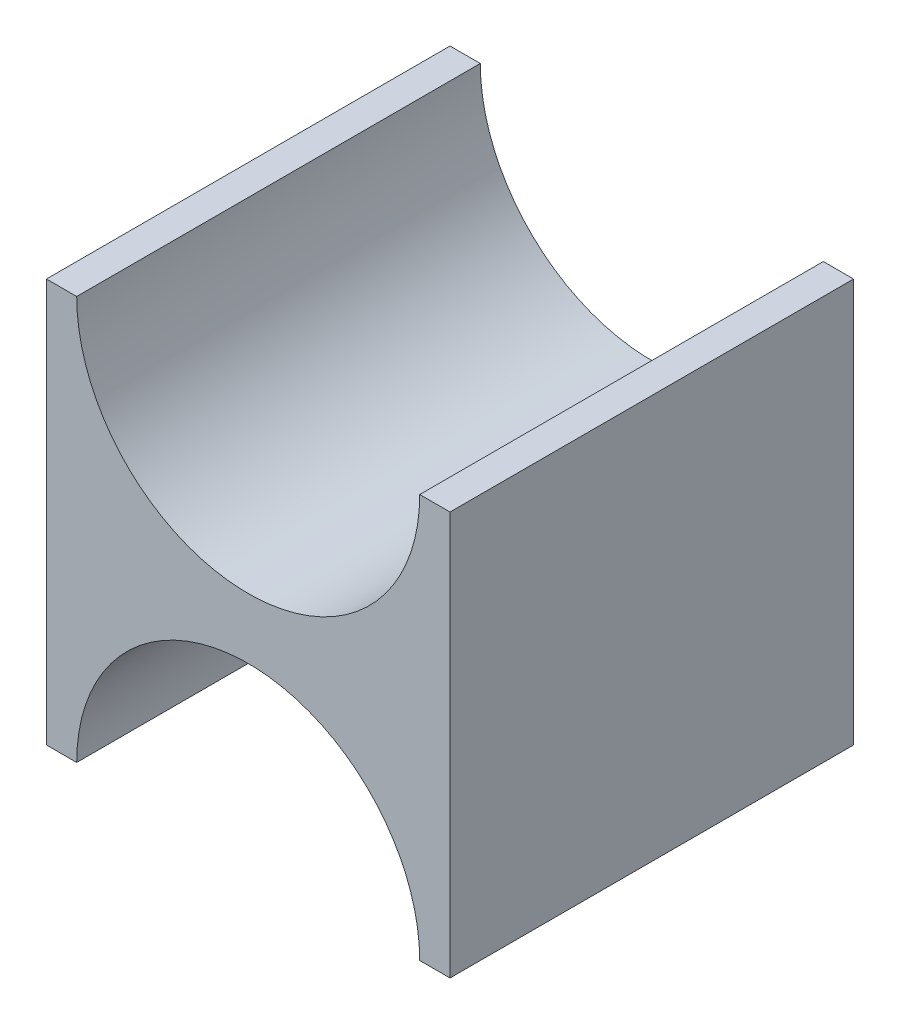
from build123d import *

# Parameters (mm, degrees)
BOSS_EXTRUDE1_DEPTH = 20


with BuildPart() as part:
    # Sketch1 → Boss-Extrude1 (new body)
    with BuildSketch(Plane.XY):
        with BuildLine():
            Line((-10, -10), (-8.5, -10))
            ThreePointArc((-8.5, -10), (0, -1.5), (8.5, -10))
            Line((8.5, -10), (10, -10))
            Line((10, -10), (10, 10))
            Line((10, 10), (8.5, 10))
            ThreePointArc((8.5, 10), (0, 1.5), (-8.5, 10))
            Line((-8.5, 10), (-10, 10))
            Line((-10, 10), (-10, -10))
        make_face()
    extrude(amount=BOSS_EXTRUDE1_DEPTH)


solid = part.part
